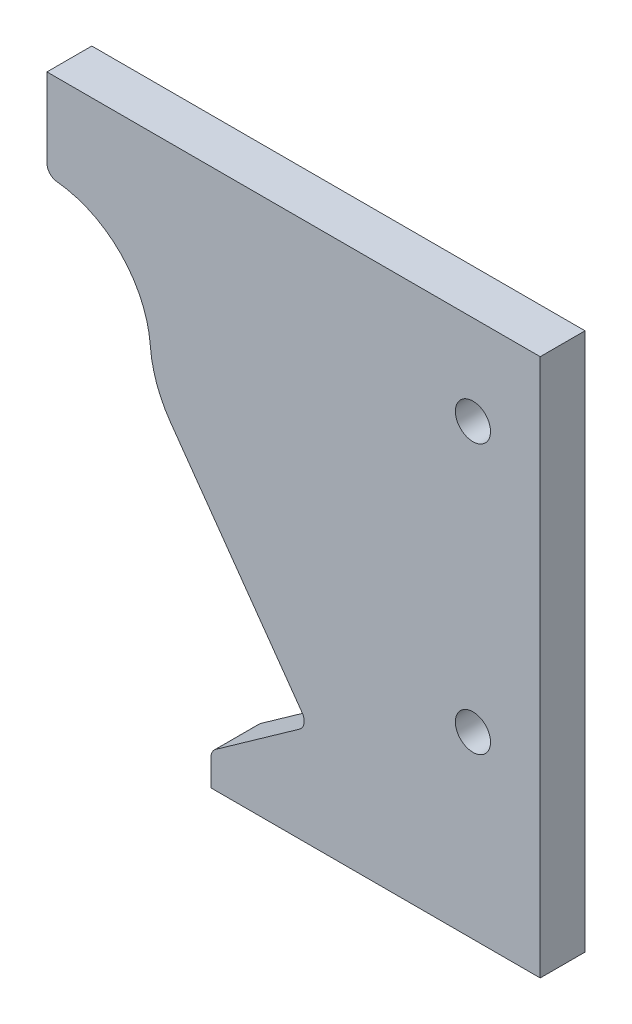
from build123d import *

# Parameters (mm, degrees)
SKETCH1_R           = 2.4892
BOSS_EXTRUDE1_DEPTH = 3.175
FILLET1_R           = 1.5875


with BuildPart() as part:
    # Sketch1 → Boss-Extrude1 (new, symmetric)
    with BuildSketch(Plane.XY):
        with BuildLine():
            Line((23.229645255, -44.228270645), (37.052935248, -34.429965394))
            Line((37.052935248, -34.429965394), (17.517315641, -6.869430374))
            ThreePointArc((17.517315641, -6.869430374), (15.535368252, -3.075379389), (14.639156809, 1.110279863))
            ThreePointArc((14.639156809, 1.110279863), (9.980916609, 10.766565705), (0, 14.6812))
            Line((0, 14.6812), (0, 27.3812))
            Line((0, 27.3812), (69.85, 27.3812))
            Line((69.85, 27.3812), (69.85, -48.8188))
            Line((69.85, -48.8188), (23.229645255, -48.8188))
            Line((23.229645255, -48.8188), (23.229645255, -44.228270645))
        make_face()
        with Locations((60.325, 14.6812)):
            Circle(SKETCH1_R, mode=Mode.SUBTRACT)
        with Locations((60.325, -23.4188)):
            Circle(SKETCH1_R, mode=Mode.SUBTRACT)
    extrude(amount=BOSS_EXTRUDE1_DEPTH, both=True)

    # Fillet1
    fillet1_edges = [part.edges().sort_by_distance(p)[0] for p in [
        (0, 14.6812, 0),
        (23.229645255, -44.228270645, 0),
        (37.052935248, -34.429965394, 0),
    ]]
    fillet(fillet1_edges, radius=FILLET1_R)


solid = part.part
